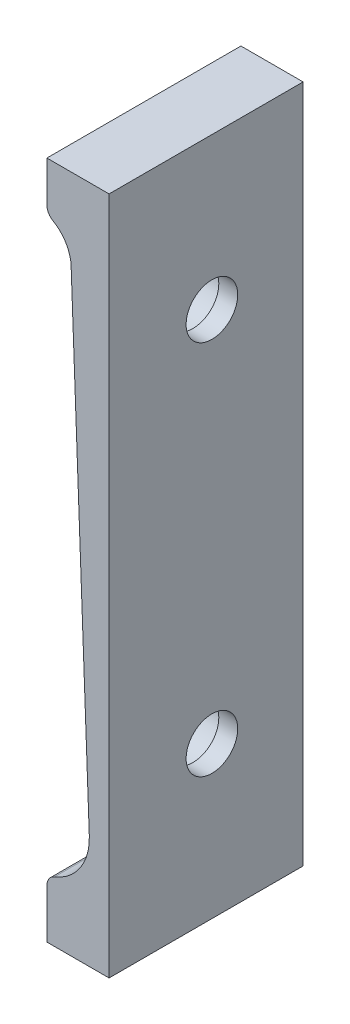
from build123d import *

# Parameters (mm, degrees)
BOSS_EXTRUDE1_DEPTH = 6.35
SKETCH3_W           = 16.2814
SKETCH3_H           = 177.8
BOSS_EXTRUDE2_DEPTH = 38.1
SKETCH5_R           = 6.75767
CUT_EXTRUDE1_DEPTH  = 194.57627713
SKETCH6_R           = 8.7641176
CUT_EXTRUDE2_DEPTH  = 11.3284
FILLET1_R           = 3.175


with BuildPart() as part:
    # Sketch1 → Boss-Extrude1 (new, symmetric)
    with BuildSketch(Plane.XY):
        with BuildLine():
            Line((110.652882407, 187.698930688), (94.371482407, 187.698930688))
            Line((94.371482407, 187.698930688), (94.371482407, 174.998930688))
            ThreePointArc((94.371482407, 174.998930688), (98.86911538, 171.662815624), (100.714782785, 166.375862067))
            Line((100.714782785, 166.375862067), (102.511582984, 118.494891962))
            Line((102.511582984, 118.494891962), (105.473932974, 39.554455817))
            ThreePointArc((105.473932974, 39.554455817), (102.530659302, 30.319876353), (94.371482407, 25.088418602))
            Line((94.371482407, 25.088418602), (94.371482407, 9.898930688))
            Line((94.371482407, 9.898930688), (110.652882407, 9.898930688))
            Line((110.652882407, 9.898930688), (110.652882407, 187.698930688))
        make_face()
    extrude(amount=BOSS_EXTRUDE1_DEPTH, both=True)

    # Sketch3 → Boss-Extrude2 (add)
    with BuildSketch(Plane(origin=(0, 0, -6.35), x_dir=(-1, 0, 0), z_dir=(0, 0, -1))):
        with Locations((-102.512182407, 98.798930688)):
            Rectangle(SKETCH3_W, SKETCH3_H)
    extrude(amount=BOSS_EXTRUDE2_DEPTH)

    # Sketch5 → Cut-Extrude1 (cut, through all)
    with BuildSketch(Plane.ZY.offset(-94.371482407)):
        with Locations(Location((-20.574, 148.010668688, 0), (0, 0, 270))):
            Circle(SKETCH5_R)
        with Locations(Location((-20.574, 49.587192688, 0), (0, 0, 270))):
            Circle(SKETCH5_R)
    extrude(amount=-CUT_EXTRUDE1_DEPTH, mode=Mode.SUBTRACT)

    # Sketch6 → Cut-Extrude2 (cut)
    with BuildSketch(Plane.ZY.offset(-94.371482407)):
        with Locations(Location((-20.574, 148.010668688, 0), (0, 0, 270))):
            Circle(SKETCH6_R)
        with Locations(Location((-20.574, 49.587192688, 0), (0, 0, 270))):
            Circle(SKETCH6_R)
    extrude(amount=-CUT_EXTRUDE2_DEPTH, mode=Mode.SUBTRACT)

    # Fillet1
    fillet1_edges = [part.edges().sort_by_distance(p)[0] for p in [
        (94.371482407, 25.088418602, 0),
        (94.371482407, 174.998930688, 0),
    ]]
    fillet(fillet1_edges, radius=FILLET1_R)


solid = part.part
